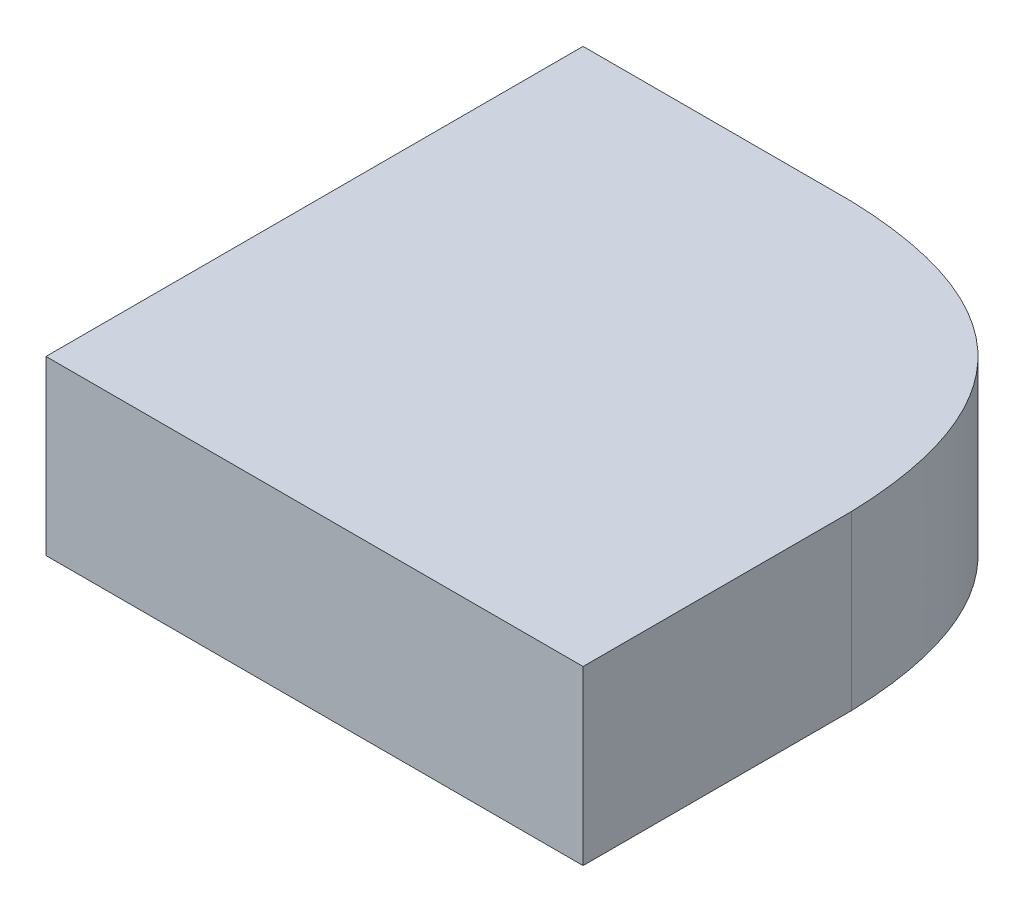
from build123d import *

# Parameters (mm, degrees)
BOSS_EXTRUDE1_DEPTH = 8


with BuildPart() as part:
    # Sketch1 → Boss-Extrude1 (new body)
    with BuildSketch(Plane(origin=(0, 0, 0), x_dir=(1, 0, 0), z_dir=(0, 1, 0))):
        with BuildLine():
            Line((0, 12.455769231), (-12.455769231, 12.455769231))
            Line((-12.455769231, 12.455769231), (-12.455769231, -12.455769231))
            Line((-12.455769231, -12.455769231), (12.455769231, -12.455769231))
            Line((12.455769231, -12.455769231), (12.455769231, 0))
            add(Edge.make_bspline(
                [(0, 12.455769231), (12.091837872, 12.091837872), (12.455769231, 0)],
                knots=[0, 0, 0, 1, 1, 1], degree=2))
        make_face()
    extrude(amount=BOSS_EXTRUDE1_DEPTH)


solid = part.part
